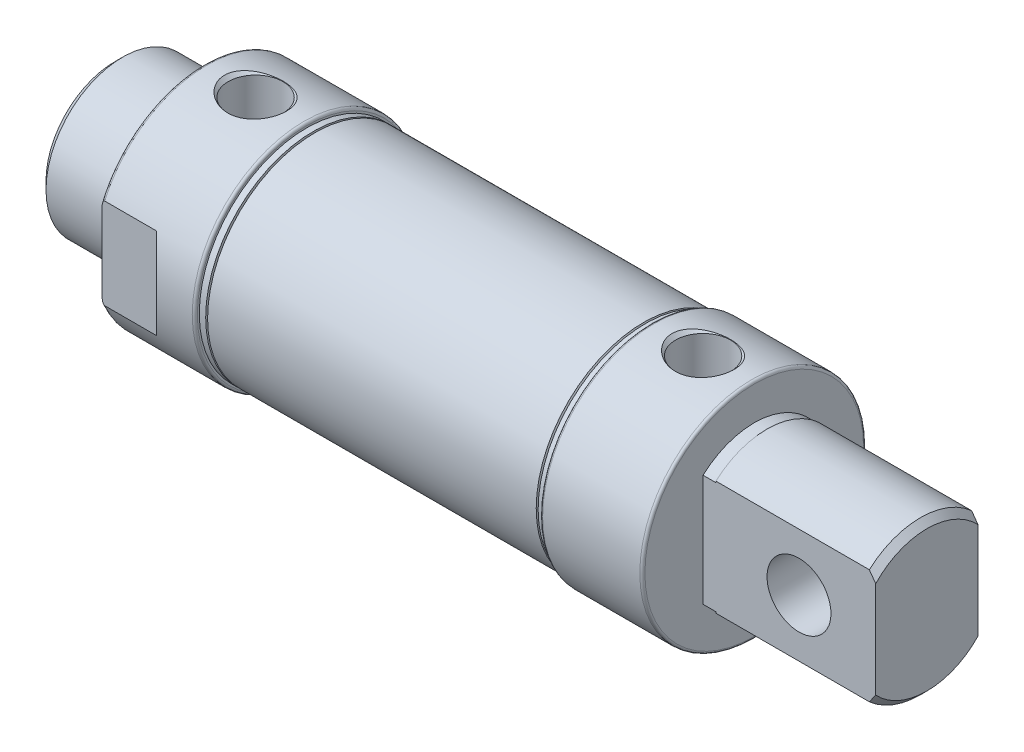
from build123d import *

# Parameters (mm, degrees)
SKETCH_3_W               = 36
SKETCH_3_H               = 44
SKETCH_3_W_2             = 16
SKETCH_3_H_2             = 24
CUT_EXTRUDE_1_DEPTH      = 27
SKETCH_4_W               = 16
SKETCH_4_H               = 5
CUT_EXTRUDE_2_DEPTH      = 35
CUT_EXTRUDE_2_DEPTH_BACK = 35


with BuildPart() as part:
    # 草图1 → 旋转1 (revolve)
    with BuildSketch(Plane.XY):
        with BuildLine():
            Line((0, 0), (0, 10.773))
            Line((0, 10.773), (1.227, 12))
            Line((1.227, 12), (14, 12))
            Line((14, 12), (14, 17.1))
            ThreePointArc((14, 17.1), (14.117157288, 17.382842712), (14.4, 17.5))
            Line((14.4, 17.5), (29.6, 17.5))
            ThreePointArc((29.6, 17.5), (29.882842712, 17.382842712), (30, 17.1))
            Line((30, 17.1), (30, 16.8))
            Line((30, 16.8), (31, 16.8))
            Line((31, 16.8), (31, 16.3))
            Line((31, 16.3), (31.3, 16.8))
            Line((31.3, 16.8), (82.7, 16.8))
            Line((82.7, 16.8), (83, 16.3))
            Line((83, 16.3), (83, 16.8))
            Line((83, 16.8), (84, 16.8))
            Line((84, 16.8), (84, 17.1))
            ThreePointArc((84, 17.1), (84.117157288, 17.382842712), (84.4, 17.5))
            Line((84.4, 17.5), (99.6, 17.5))
            ThreePointArc((99.6, 17.5), (99.882842712, 17.382842712), (100, 17.1))
            Line((100, 17.1), (100, 0))
            Line((100, 0), (0, 0))
        make_face()
    revolve(axis=Axis((100, 0, 0), (-1, 0, 0)))

    # 草图2 → 旋转2 (revolve)
    with BuildSketch(Plane.XY):
        Polygon((100, 0), (100, 11.85), (102, 11.85), (102, 12), (126, 12), (127, 11), (127, 0), align=None)
    revolve(axis=Axis((127, 0, 0), (-1, 0, 0)))

    # 草图3 → 切除-拉伸1 (cut)
    with BuildSketch(Plane(origin=(127, 0, 0), x_dir=(0, 0, -1), z_dir=(1, 0, 0))):
        Rectangle(SKETCH_3_W, SKETCH_3_H)
        Rectangle(SKETCH_3_W_2, SKETCH_3_H_2, mode=Mode.SUBTRACT)
    extrude(amount=-CUT_EXTRUDE_1_DEPTH, mode=Mode.SUBTRACT)

    # 草图4 → 切除-旋转1 (revolve, cut)
    with BuildSketch(Plane(origin=(115, 0, 0), x_dir=(0, 0, -1), z_dir=(1, 0, 0))):
        with Locations((0, 2.5)):
            Rectangle(SKETCH_4_W, SKETCH_4_H)
    revolve(axis=Axis((115, 0, -8), (0, 0, 1)), mode=Mode.SUBTRACT)

    # 草图5 → 切除-旋转2 (revolve, cut)
    with BuildSketch(Plane.XY):
        Polygon((22, 17.5), (26.864, 17.5), (26.283, 16.919), (26.283, 9.5), (22, 9.5), align=None)
    revolve(axis=Axis((22, 9.5, 0), (0, 1, 0)), mode=Mode.SUBTRACT)

    # 草图6 → 切除-旋转3 (revolve, cut)
    with BuildSketch(Plane.XY):
        Polygon((92, 17.5), (96.864, 17.5), (96.283, 16.919), (96.283, 9.5), (92, 9.5), align=None)
    revolve(axis=Axis((92, 9.5, 0), (0, 1, 0)), mode=Mode.SUBTRACT)

    # 草图7 → 切除-拉伸2 (cut, two sides: drawn at the far end of the back side and taken through both)
    with BuildSketch(Plane(origin=(0, 0, 0), x_dir=(1, 0, 0), z_dir=(0, 1, 0)).offset(-CUT_EXTRUDE_2_DEPTH_BACK)):
        Polygon((-4, -17.5), (24, -17.5), (22.5, -16), (-2, -16), (-2, 16), (22.5, 16), (24, 17.5), (-4, 17.5), align=None)
    extrude(amount=CUT_EXTRUDE_2_DEPTH + CUT_EXTRUDE_2_DEPTH_BACK, mode=Mode.SUBTRACT)

    # 草图8 → 切除-旋转4 (revolve, cut)
    with BuildSketch(Plane.XY):
        Polygon((0, 0), (0, 6), (41, 6), (41, 16), (73, 16), (73, 0), align=None)
    revolve(axis=Axis((73, 0, 0), (-1, 0, 0)), mode=Mode.SUBTRACT)


solid = part.part
